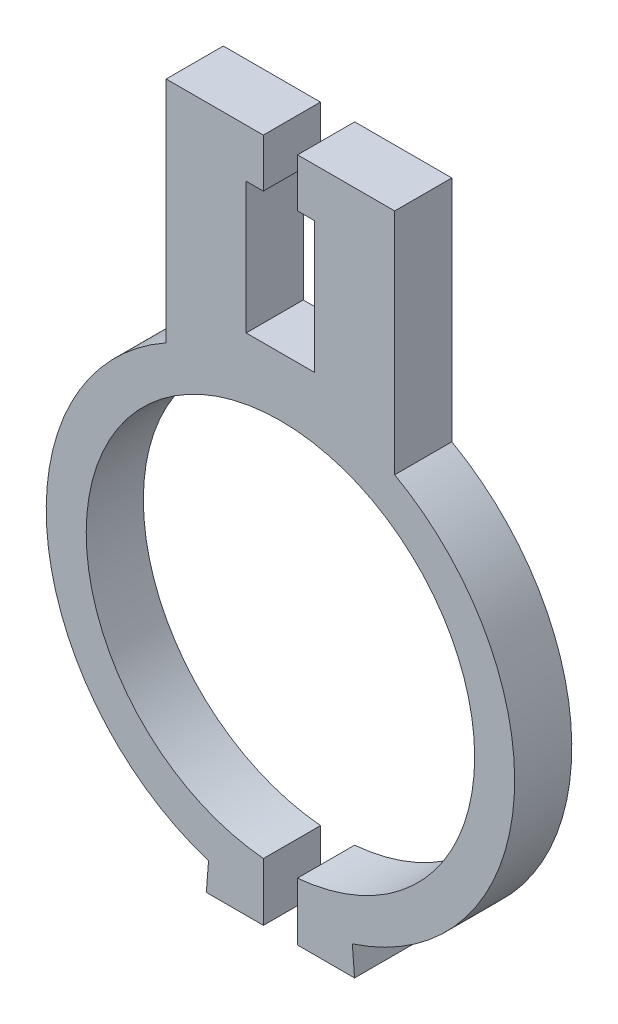
from build123d import *

# Parameters (mm, degrees)
SALIENTE_EXTRUIR1_DEPTH = 10


with BuildPart() as part:
    # Croquis1 → Saliente-Extruir1 (new body)
    with BuildSketch(Plane.XY):
        with BuildLine():
            Line((-20, 35.791060336), (-20, 75.791060336))
            Line((-20, 75.791060336), (-3, 75.791060336))
            Line((-3, 75.791060336), (-3, 67.291060336))
            Line((-3, 67.291060336), (-6, 67.291060336))
            Line((-6, 67.291060336), (-6, 44.291060336))
            Line((-6, 44.291060336), (-3, 44.291060336))
            Line((-3, 44.291060336), (3, 44.291060336))
            Line((3, 44.291060336), (6, 44.291060336))
            Line((6, 44.291060336), (6, 67.291060336))
            Line((6, 67.291060336), (3, 67.291060336))
            Line((3, 67.291060336), (3, 75.791060336))
            Line((3, 75.791060336), (20, 75.791060336))
            Line((20, 75.791060336), (20, 35.791060336))
            ThreePointArc((20, 35.791060336), (40.799890092, -4.04585819), (12.581284853, -39.02193321))
            Line((12.581284853, -39.02193321), (12.975031737, -44.006405438))
            Line((12.975031737, -44.006405438), (2.975031737, -44.006405438))
            Line((2.975031737, -44.006405438), (2.975031737, -40.891920793))
            Line((2.975031737, -40.891920793), (2.975031737, -33.869590877))
            ThreePointArc((2.975031737, -33.869590877), (0, 34), (-2.975031737, -33.869590877))
            Line((-2.975031737, -33.869590877), (-2.975031737, -40.891920793))
            Line((-2.975031737, -40.891920793), (-2.975031737, -44.006405438))
            Line((-2.975031737, -44.006405438), (-12.975031737, -44.006405438))
            Line((-12.975031737, -44.006405438), (-12.581284853, -39.02193321))
            ThreePointArc((-12.581284853, -39.02193321), (-40.799890092, -4.04585819), (-20, 35.791060336))
        make_face()
    extrude(amount=SALIENTE_EXTRUIR1_DEPTH)


solid = part.part
